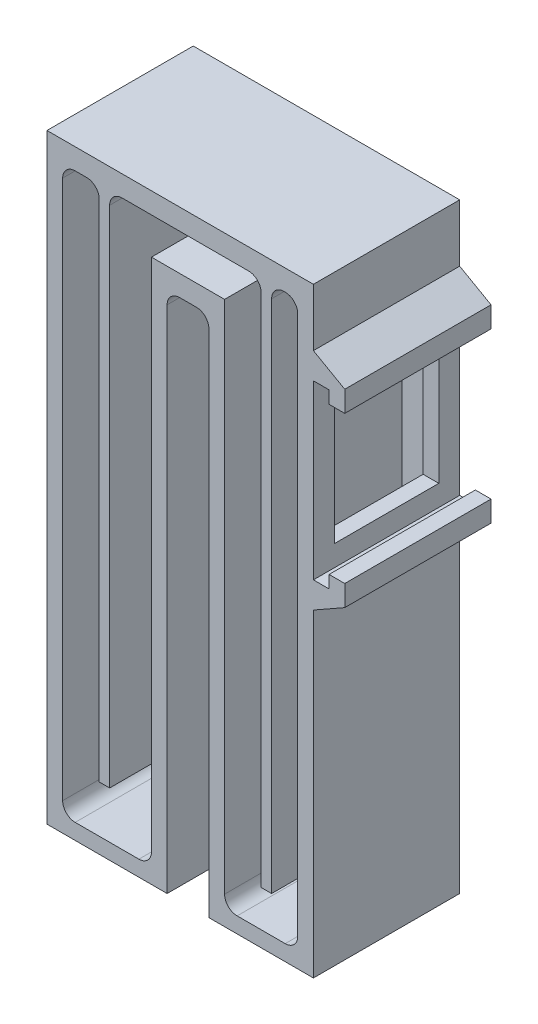
from build123d import *

# Parameters (mm, degrees)
BOSS_EXTRUDE1_DEPTH = 25
BOSS_EXTRUDE2_START = -3
BOSS_EXTRUDE2_DEPTH = 3
CUT_EXTRUDE1_REACH  = 130.261
SKETCH3_W           = 20
SKETCH3_H           = 25
BOSS_EXTRUDE3_DEPTH = 28


with BuildPart() as part:
    # Sketch1 → Boss-Extrude1 (new body)
    with BuildSketch(Plane.XY):
        with BuildLine():
            Line((0, 0), (0, 97.6))
            ThreePointArc((0, 97.6), (0.702943725, 99.297056275), (2.4, 100))
            Line((2.4, 100), (5.6, 100))
            ThreePointArc((5.6, 100), (7.297056275, 99.297056275), (8, 97.6))
            Line((8, 97.6), (8, 0))
            Line((8, 0), (28, 0))
            Line((28, 0), (28, 115))
            Line((28, 115), (18, 115))
            Line((18, 115), (-10, 115))
            Line((-10, 115), (-23, 115))
            Line((-23, 115), (-23, 0))
            Line((-23, 0), (0, 0))
        make_face()
        with BuildLine():
            Line((18, 108.6), (18, 10))
            Line((18, 10), (20, 10))
            Line((20, 10), (20, 108.6))
            ThreePointArc((20, 108.6), (20.702943725, 110.297056275), (22.4, 111))
            Line((22.4, 111), (22.6, 111))
            ThreePointArc((22.6, 111), (24.297056275, 110.297056275), (25, 108.6))
            Line((25, 108.6), (25, 5.4))
            ThreePointArc((25, 5.4), (24.297056275, 3.702943725), (22.6, 3))
            Line((22.6, 3), (13.4, 3))
            ThreePointArc((13.4, 3), (11.702943725, 3.702943725), (11, 5.4))
            Line((11, 5.4), (11, 104))
            Line((11, 104), (-3, 104))
            Line((-3, 104), (-3, 5.4))
            ThreePointArc((-3, 5.4), (-3.702943725, 3.702943725), (-5.4, 3))
            Line((-5.4, 3), (-17.6, 3))
            ThreePointArc((-17.6, 3), (-19.297056275, 3.702943725), (-20, 5.4))
            Line((-20, 5.4), (-20, 108.6))
            ThreePointArc((-20, 108.6), (-19.297056275, 110.297056275), (-17.6, 111))
            Line((-17.6, 111), (-15.4, 111))
            ThreePointArc((-15.4, 111), (-13.702943725, 110.297056275), (-13, 108.6))
            Line((-13, 108.6), (-13, 12))
            Line((-13, 12), (-11, 12))
            Line((-11, 12), (-11, 108.6))
            ThreePointArc((-11, 108.6), (-10.297056275, 110.297056275), (-8.6, 111))
            Line((-8.6, 111), (15.6, 111))
            ThreePointArc((15.6, 111), (17.297056275, 110.297056275), (18, 108.6))
        make_face(mode=Mode.SUBTRACT)
    extrude(amount=BOSS_EXTRUDE1_DEPTH)

    # Sketch2 → Boss-Extrude2 (add)
    with BuildSketch(Plane.XY.offset(BOSS_EXTRUDE2_START)):
        with BuildLine():
            Line((28, 115), (-23, 115))
            Line((-23, 115), (-23, 0))
            Line((-23, 0), (0, 0))
            Line((0, 0), (0, 97.6))
            ThreePointArc((0, 97.6), (0.702943725, 99.297056275), (2.4, 100))
            Line((2.4, 100), (5.6, 100))
            ThreePointArc((5.6, 100), (7.297056275, 99.297056275), (8, 97.6))
            Line((8, 97.6), (8, 0))
            Line((8, 0), (28, 0))
            Line((28, 0), (28, 115))
        make_face()
    extrude(amount=BOSS_EXTRUDE2_DEPTH)

    # Sketch3 → Cut-Extrude1 (cut, up to next)
    with BuildSketch(Plane(origin=(28, 0, 0), x_dir=(0, 0, -1), z_dir=(1, 0, 0)), mode=Mode.PRIVATE) as cut_extrude1_sk1:
        with Locations((-11, 82.5)):
            Rectangle(SKETCH3_W, SKETCH3_H)
    cut_extrude1_tool1 = extrude(cut_extrude1_sk1.sketch, amount=-CUT_EXTRUDE1_REACH, mode=Mode.PRIVATE) & part.part
    add(cut_extrude1_tool1.solids().sort_by_distance((28, 82.5, 11))[0], mode=Mode.SUBTRACT)

    # Sketch4 → Boss-Extrude3 (add)
    with BuildSketch(Plane(origin=(0, 0, -3), x_dir=(-1, 0, 0), z_dir=(0, 0, -1))):
        Polygon((-28, 99), (-31, 99), (-31, 96.6), (-34, 96.6), (-34, 100.6), (-28, 104), align=None)
        Polygon((-28, 61), (-28, 66), (-31, 66), (-31, 68.4), (-34, 68.4), (-34, 64.4), align=None)
    extrude(amount=-BOSS_EXTRUDE3_DEPTH)


solid = part.part
